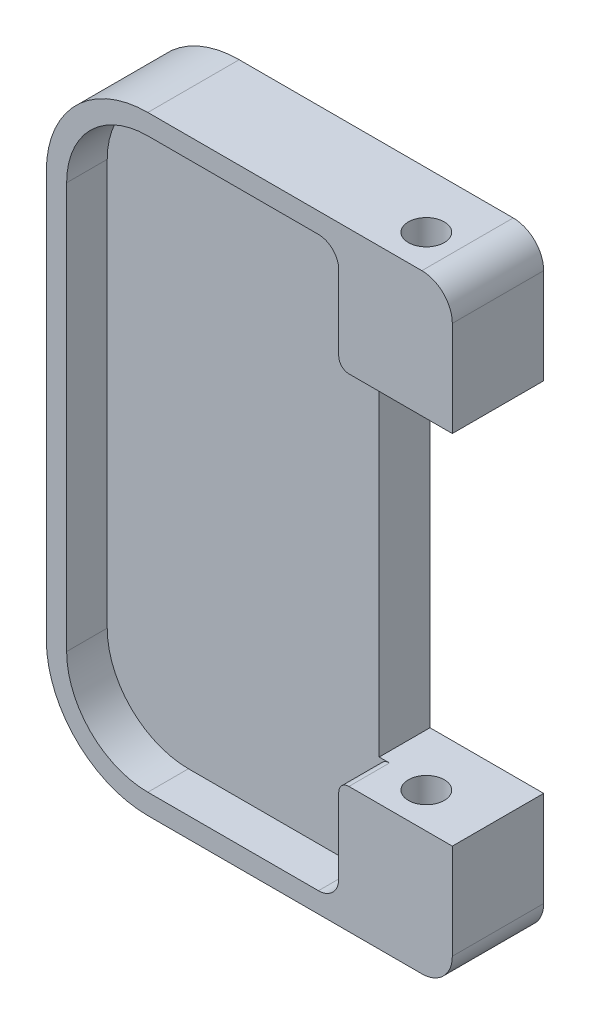
from build123d import *

# Parameters (mm, degrees)
SKETCH1_W                = 114.3
SKETCH1_H                = 44.45
BOSS_EXTRUDE1_DEPTH      = 62.23
SKETCH2_W                = 114.3
SKETCH2_H                = 30.050000124
CUT_EXTRUDE2_DEPTH       = 31.75
SKETCH3_W                = 114.3
SKETCH3_H                = 31.75
CUT_EXTRUDE3_DEPTH       = 21.59
CUT_EXTRUDE6_REACH       = 97.47
SKETCH7_R                = 4.8
CUT_EXTRUDE7_DEPTH       = 70.051688068
CUT_EXTRUDE7_DEPTH_BACK  = 70.051688068
SKETCH9_W                = 44.45
SKETCH9_H                = 30.050000124
CUT_EXTRUDE8_DEPTH       = 96.469879543
BOSS_EXTRUDE2_REACH      = 92.305
SKETCH14_W               = 21.59
SKETCH14_H               = 5.500000062
SKETCH17_W               = 44.45
SKETCH17_H               = 5.500000062
BOSS_EXTRUDE3_DEPTH      = 8.89
SKETCH20_W               = 50.8
SKETCH20_H               = 76.2
BOSS_EXTRUDE5_DEPTH      = 8.89
FILLET4_R                = 12.7
CUT_EXTRUDE10_DEPTH      = 2.54
CUT_EXTRUDE11_DEPTH      = 124.171316568
CUT_EXTRUDE11_DEPTH_BACK = 124.171316568
SKETCH22_R               = 4.8
SKETCH25_W               = 10.312122602
SKETCH25_H               = 7.199999938
CUT_EXTRUDE14_DEPTH      = 17.272
SKETCH26_W               = 10.312122602
SKETCH26_H               = 7.199999938
CUT_EXTRUDE15_DEPTH      = 17.272
CUT_EXTRUDE16_DEPTH      = 121.990414496
CUT_EXTRUDE16_DEPTH_BACK = 121.990414496
SKETCH32_R               = 2.2479
FILLET5_R                = 3.81
CUT_EXTRUDE22_DEPTH      = 98.128019129
BOSS_EXTRUDE6_DEPTH      = 10.922
BOSS_EXTRUDE7_START      = 10.922
BOSS_EXTRUDE7_DEPTH      = 10.922
BOSS_EXTRUDE8_DEPTH      = 2.54
CUT_EXTRUDE23_DEPTH      = 2.54
BOSS_EXTRUDE10_DEPTH     = 1.143
BOSS_EXTRUDE13_START     = -2.54
BOSS_EXTRUDE13_DEPTH     = 2.54
SKETCH59_W               = 5.08
SKETCH59_H               = 13.208
BOSS_EXTRUDE16_DEPTH     = 1.3589
FILLET6_R                = 2.54
FILLET7_R                = 1.27


with BuildPart() as part:
    # Sketch1 → Boss-Extrude1 (new body)
    with BuildSketch(Plane.XY):
        Rectangle(SKETCH1_W, SKETCH1_H)
    extrude(amount=BOSS_EXTRUDE1_DEPTH)

    # Sketch2 → Cut-Extrude2 (cut)
    with BuildSketch(Plane.XY.offset(62.23)):
        Rectangle(SKETCH2_W, SKETCH2_H)
    extrude(amount=-CUT_EXTRUDE2_DEPTH, mode=Mode.SUBTRACT)

    # Sketch3 → Cut-Extrude3 (cut)
    with BuildSketch(Plane(origin=(0, 0, 0), x_dir=(-1, 0, 0), z_dir=(0, 0, -1))):
        with Locations((0, 6.35)):
            Rectangle(SKETCH3_W, SKETCH3_H)
    extrude(amount=-CUT_EXTRUDE3_DEPTH, mode=Mode.SUBTRACT)

    # Cut-Extrude6: up to this face of the body (flat: up to its plane)
    cut_extrude6_end = Plane(part.part.faces().sort_by_distance((0, 22.225, 41.91))[0])
    # Sketch7 → Cut-Extrude6 (cut, up to the picked face)
    with BuildSketch(Plane.XZ.offset(22.225), mode=Mode.PRIVATE) as cut_extrude6_sk1:
        with Locations((31.75, 50.36)):
            Circle(SKETCH7_R)
    cut_extrude6_tool1 = split(extrude(cut_extrude6_sk1.sketch, amount=-CUT_EXTRUDE6_REACH, mode=Mode.PRIVATE), bisect_by=cut_extrude6_end, keep=Keep.BOTH, mode=Mode.PRIVATE)
    # Sketch7 → Cut-Extrude6 (cut, up to the picked face)
    with BuildSketch(Plane.XZ.offset(22.225), mode=Mode.PRIVATE) as cut_extrude6_sk2:
        with Locations((-27.14, 39.37)):
            Circle(SKETCH7_R)
    cut_extrude6_tool2 = split(extrude(cut_extrude6_sk2.sketch, amount=-CUT_EXTRUDE6_REACH, mode=Mode.PRIVATE), bisect_by=cut_extrude6_end, keep=Keep.BOTH, mode=Mode.PRIVATE)
    add(cut_extrude6_tool1.solids().sort_by(Axis((31.75, -22.225, 50.36), (0, 1, 0)))[0], mode=Mode.SUBTRACT)
    add(cut_extrude6_tool2.solids().sort_by(Axis((-27.14, -22.225, 39.37), (0, 1, 0)))[0], mode=Mode.SUBTRACT)

    # Sketch9 → Cut-Extrude7 (cut, two sides: drawn at the far end of the back side and taken through both)
    with BuildSketch(Plane.XY.offset(30.48).offset(-CUT_EXTRUDE7_DEPTH_BACK)):
        with Locations((-15.875, 0)):
            Rectangle(SKETCH9_W, SKETCH9_H)
    extrude(amount=CUT_EXTRUDE7_DEPTH + CUT_EXTRUDE7_DEPTH_BACK, mode=Mode.SUBTRACT)

    # Sketch16 → Cut-Extrude8 (cut, through all)
    with BuildSketch(Plane.XZ.offset(22.225)):
        with BuildLine():
            Line((-57.15, 62.23), (57.15, 62.23))
            Line((57.15, 62.23), (57.15, 47.010251521))
            Line((57.15, 47.010251521), (41.63, 50.36))
            ThreePointArc((41.63, 50.36), (31.75, 60.24), (21.87, 50.36))
            Line((21.87, 50.36), (-15.99, 39.37))
            ThreePointArc((-15.99, 39.37), (-26.807602145, 50.515044265), (-38.270181465, 40.034500235))
            ThreePointArc((-38.270181465, 40.034500235), (-41.445282487, 33.244816513), (-48.412122602, 30.48))
            Line((-48.412122602, 30.48), (-57.15, 30.48))
            Line((-57.15, 30.48), (-57.15, 62.23))
        make_face()
    extrude(amount=-CUT_EXTRUDE8_DEPTH, mode=Mode.SUBTRACT)

    # Sketch14 → Boss-Extrude2 (add, up to next)
    with BuildSketch(Plane.ZY.offset(-6.35), mode=Mode.PRIVATE) as boss_extrude2_sk1:
        with Locations((10.795, -12.275000031)):
            Rectangle(SKETCH14_W, SKETCH14_H)
    boss_extrude2_tool1 = extrude(boss_extrude2_sk1.sketch, amount=BOSS_EXTRUDE2_REACH, mode=Mode.PRIVATE) - part.part
    add(boss_extrude2_tool1.solids().sort_by_distance((6.35, -12.275, 10.795))[0])

    # Sketch17 → Boss-Extrude3 (add)
    with BuildSketch(Plane.XY.offset(21.59)):
        with Locations((-15.875, -12.275000031)):
            Rectangle(SKETCH17_W, SKETCH17_H)
    extrude(amount=BOSS_EXTRUDE3_DEPTH)

    # Sketch20 → Boss-Extrude5 (add)
    with BuildSketch(Plane(origin=(0, 0, 21.59), x_dir=(-1, 0, 0), z_dir=(0, 0, -1))):
        with Locations((63.5, 0)):
            Rectangle(SKETCH20_W, SKETCH20_H)
    extrude(amount=-BOSS_EXTRUDE5_DEPTH)

    # Fillet4
    fillet4_edges = [part.edges().sort_by_distance(p)[0] for p in [
        (-88.9, 38.1, 26.035),
        (-88.9, -38.1, 26.035),
    ]]
    fillet(fillet4_edges, radius=FILLET4_R)

    # Sketch21 → Cut-Extrude10 (cut)
    with BuildSketch(Plane.XY.offset(30.48)):
        with BuildLine():
            Line((-76.2, -35.56), (-40.64, -35.56))
            Line((-40.64, -35.56), (-40.64, -24.765))
            Line((-40.64, -24.765), (-50.952122602, -24.765))
            Line((-50.952122602, -24.765), (-50.952122602, -12.485000062))
            Line((-50.952122602, -12.485000062), (-40.64, -12.485000062))
            Line((-40.64, -12.485000062), (-40.64, -12.065))
            Line((-40.64, -12.065), (-40.64, 12.485000062))
            Line((-40.64, 12.485000062), (-50.952122602, 12.485000062))
            Line((-50.952122602, 12.485000062), (-50.952122602, 24.765))
            Line((-50.952122602, 24.765), (-40.64, 24.765))
            Line((-40.64, 24.765), (-40.64, 35.56))
            Line((-40.64, 35.56), (-76.2, 35.56))
            ThreePointArc((-76.2, 35.56), (-83.384204897, 32.584204897), (-86.36, 25.4))
            Line((-86.36, 25.4), (-86.36, -25.4))
            ThreePointArc((-86.36, -25.4), (-83.384204897, -32.584204897), (-76.2, -35.56))
        make_face()
    extrude(amount=-CUT_EXTRUDE10_DEPTH, mode=Mode.SUBTRACT)

    # Sketch22 → Cut-Extrude11 (cut, two sides: drawn at the far end of the back side and taken through both)
    with BuildSketch(Plane.XZ.offset(22.225).offset(-CUT_EXTRUDE11_DEPTH_BACK)):
        with BuildLine():
            Line((-38.1, 30.48), (-38.270181465, 40.034500235))
            ThreePointArc((-38.270181465, 40.034500235), (-26.807602145, 50.515044265), (-15.99, 39.37))
            Line((-15.99, 39.37), (21.87, 50.36))
            ThreePointArc((21.87, 50.36), (31.75, 60.24), (41.63, 50.36))
            Line((41.63, 50.36), (57.15, 47.010251521))
            Line((57.15, 47.010251521), (57.15, 0))
            Line((57.15, 0), (-57.15, 0))
            Line((-57.15, 0), (-57.15, 21.59))
            Line((-57.15, 21.59), (-38.1, 21.59))
            Line((-38.1, 21.59), (-38.1, 30.48))
        make_face()
        with Locations((31.75, 50.36)):
            Circle(SKETCH22_R, mode=Mode.SUBTRACT)
        with Locations((-27.14, 39.37)):
            Circle(SKETCH22_R, mode=Mode.SUBTRACT)
    extrude(amount=CUT_EXTRUDE11_DEPTH + CUT_EXTRUDE11_DEPTH_BACK, mode=Mode.SUBTRACT)

    # Sketch25 → Cut-Extrude14 (cut)
    with BuildSketch(Plane.XY.offset(30.48)):
        with Locations((-43.256061301, -18.625000031)):
            Rectangle(SKETCH25_W, SKETCH25_H)
    extrude(amount=CUT_EXTRUDE14_DEPTH, mode=Mode.SUBTRACT)

    # Sketch26 → Cut-Extrude15 (cut)
    with BuildSketch(Plane.XY.offset(30.48)):
        with Locations((-43.256061301, 18.625000031)):
            Rectangle(SKETCH26_W, SKETCH26_H)
    extrude(amount=CUT_EXTRUDE15_DEPTH, mode=Mode.SUBTRACT)

    # Sketch32 → Cut-Extrude16 (cut, two sides: drawn at the far end of the back side and taken through both)
    with BuildSketch(Plane.XZ.offset(38.1).offset(-CUT_EXTRUDE16_DEPTH_BACK)):
        with Locations(Location((-45.796061301, 26.035, 0), (0, 0, 270))):
            Circle(SKETCH32_R)
    extrude(amount=CUT_EXTRUDE16_DEPTH + CUT_EXTRUDE16_DEPTH_BACK, mode=Mode.SUBTRACT)

    # Fillet5
    fillet5_edges = [part.edges().sort_by_distance(p)[0] for p in [
        (-38.1, -38.1, 26.035),
        (-38.1, 38.1, 26.035),
    ]]
    fillet(fillet5_edges, radius=FILLET5_R)

    # Sketch33 → Cut-Extrude22 (cut, through all)
    with BuildSketch(Plane.XY.offset(30.48)):
        Polygon((-38.1, -22.352), (-38.1, 0), (-38.1, 22.352), (-53.467, 22.352), (-53.467, -22.352), align=None)
    extrude(amount=-CUT_EXTRUDE22_DEPTH, mode=Mode.SUBTRACT)

    # Sketch41 → Boss-Extrude6 (add)
    with BuildSketch(Plane.XZ.offset(24.765)):
        with BuildLine():
            Line((-44.602734267, 27.94), (-40.64, 27.94))
            Line((-40.64, 27.94), (-40.64, 30.48))
            Line((-40.64, 30.48), (-50.952122602, 30.48))
            Line((-50.952122602, 30.48), (-50.952122602, 27.94))
            Line((-50.952122602, 27.94), (-46.989388335, 27.94))
            ThreePointArc((-46.989388335, 27.94), (-45.796061301, 28.255730444), (-44.602734267, 27.94))
        make_face()
    extrude(amount=BOSS_EXTRUDE6_DEPTH)

    # Sketch44 → Boss-Extrude7 (add)
    with BuildSketch(Plane(origin=(0, 24.765, 0), x_dir=(1, 0, 0), z_dir=(0, 1, 0)).offset(BOSS_EXTRUDE7_START)):
        with BuildLine():
            Line((-44.602734267, -27.94), (-40.64, -27.94))
            Line((-40.64, -27.94), (-40.64, -30.48))
            Line((-40.64, -30.48), (-50.952122602, -30.48))
            Line((-50.952122602, -30.48), (-50.952122602, -27.94))
            Line((-50.952122602, -27.94), (-46.989388335, -27.94))
            ThreePointArc((-46.989388335, -27.94), (-45.796061301, -28.255730444), (-44.602734267, -27.94))
        make_face()
    extrude(amount=-BOSS_EXTRUDE7_DEPTH)

    # Sketch45 → Boss-Extrude8 (add)
    with BuildSketch(Plane(origin=(0, 0, 21.59), x_dir=(-1, 0, 0), z_dir=(0, 0, -1))):
        with BuildLine():
            Line((53.467, 22.352), (53.467, -22.352))
            Line((53.467, -22.352), (53.467, -38.1))
            Line((53.467, -38.1), (76.2, -38.1))
            ThreePointArc((76.2, -38.1), (85.180256121, -34.380256121), (88.9, -25.4))
            Line((88.9, -25.4), (88.9, 25.4))
            ThreePointArc((88.9, 25.4), (85.180256121, 34.380256121), (76.2, 38.1))
            Line((76.2, 38.1), (53.467, 38.1))
            Line((53.467, 38.1), (53.467, 22.352))
        make_face()
    extrude(amount=BOSS_EXTRUDE8_DEPTH)

    # Sketch47 → Cut-Extrude23 (cut)
    with BuildSketch(Plane.XY.offset(27.94)):
        with BuildLine():
            Line((-53.467, 22.352), (-53.467, -22.352))
            Line((-53.467, -22.352), (-50.952122602, -22.352))
            Line((-50.952122602, -22.352), (-50.952122602, -35.56))
            Line((-50.952122602, -35.56), (-76.2, -35.56))
            ThreePointArc((-76.2, -35.56), (-83.384204897, -32.584204897), (-86.36, -25.4))
            Line((-86.36, -25.4), (-86.36, 25.4))
            ThreePointArc((-86.36, 25.4), (-83.384204897, 32.584204897), (-76.2, 35.56))
            Line((-76.2, 35.56), (-50.952122602, 35.56))
            Line((-50.952122602, 35.56), (-50.952122602, 22.352))
            Line((-50.952122602, 22.352), (-53.467, 22.352))
        make_face()
    extrude(amount=-CUT_EXTRUDE23_DEPTH, mode=Mode.SUBTRACT)

    # Sketch49 → Boss-Extrude10 (add)
    with BuildSketch(Plane(origin=(-53.467, 0, 0), x_dir=(0, 0, -1), z_dir=(1, 0, 0))):
        Polygon((-21.59, 38.1), (-19.05, 38.1), (-19.05, -38.1), (-21.59, -38.1), (-21.59, -22.352), (-25.4, -22.352), (-25.4, 22.352), (-21.59, 22.352), align=None)
    extrude(amount=BOSS_EXTRUDE10_DEPTH)

    # Sketch54 → Boss-Extrude13 (add)
    with BuildSketch(Plane(origin=(0, 0, 19.05), x_dir=(-1, 0, 0), z_dir=(0, 0, -1)).offset(BOSS_EXTRUDE13_START)):
        with BuildLine():
            Line((38.1, 22.352), (52.324, 22.352))
            Line((52.324, 22.352), (52.324, 38.1))
            Line((52.324, 38.1), (41.91, 38.1))
            ThreePointArc((41.91, 38.1), (39.215923164, 36.984076836), (38.1, 34.29))
            Line((38.1, 34.29), (38.1, 22.352))
        make_face()
        with BuildLine():
            Line((41.91, -38.1), (52.324, -38.1))
            Line((52.324, -38.1), (52.324, -22.352))
            Line((52.324, -22.352), (38.1, -22.352))
            Line((38.1, -22.352), (38.1, -34.29))
            ThreePointArc((38.1, -34.29), (39.215923164, -36.984076836), (41.91, -38.1))
        make_face()
    extrude(amount=BOSS_EXTRUDE13_DEPTH)

    # Sketch59 → Boss-Extrude16 (add)
    with BuildSketch(Plane.ZY.offset(50.952122602)):
        with Locations((27.94, 28.956)):
            Rectangle(SKETCH59_W, SKETCH59_H)
        with Locations((27.94, -28.956)):
            Rectangle(SKETCH59_W, SKETCH59_H)
    extrude(amount=BOSS_EXTRUDE16_DEPTH)

    # Fillet6
    fillet6_edges = [part.edges().sort_by_distance(p)[0] for p in [
        (-52.311022602, 35.56, 27.94),
        (-52.311022602, -35.56, 27.94),
    ]]
    fillet(fillet6_edges, radius=FILLET6_R)

    # Fillet7
    fillet7_edges = [part.edges().sort_by_distance(p)[0] for p in [
        (-52.311022602, 22.352, 27.94),
        (-52.311022602, -22.352, 27.94),
    ]]
    fillet(fillet7_edges, radius=FILLET7_R)


solid = part.part
